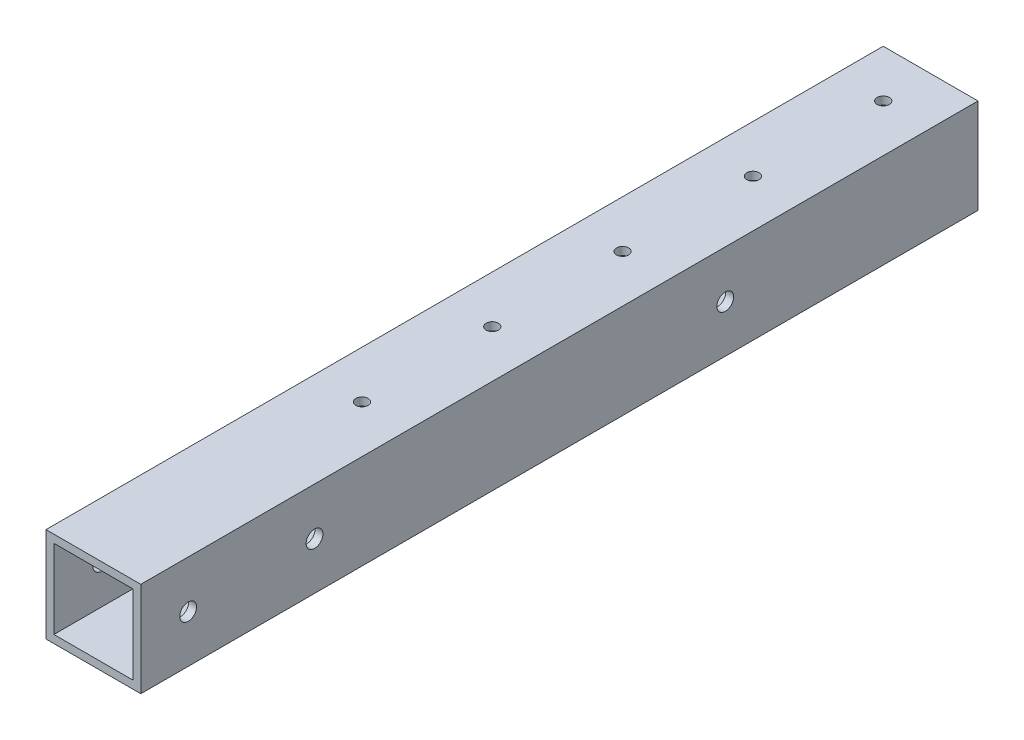
from build123d import *

# Parameters (mm, degrees)
BOSS_EXTRUDE1_DEPTH          = 165.1
BOSS_EXTRUDE1_DEPTH_BACK     = 171.45
SKETCH1_W                    = 38.1
SKETCH1_H                    = 38.1
SKETCH1_W_2                  = 31.75
SKETCH1_H_2                  = 31.75
F_1_4_CLEARANCE_HOLE1_D      = 6.7564
F_10_0_1935_DIAMETER_HOLE1_D = 4.9149


with BuildPart() as part:
    # Sketch1 → Boss-Extrude1 (new, two sides: drawn at the far end of the back side and taken through both)
    with BuildSketch(Plane.XY.offset(-BOSS_EXTRUDE1_DEPTH_BACK)):
        Rectangle(SKETCH1_W, SKETCH1_H)
        Rectangle(SKETCH1_W_2, SKETCH1_H_2, mode=Mode.SUBTRACT)
    extrude(amount=BOSS_EXTRUDE1_DEPTH + BOSS_EXTRUDE1_DEPTH_BACK)

    # 1/4 Clearance Hole1 (through all)
    with Locations(Plane(origin=(19.05, 0, 0), x_dir=(0, 0, -1), z_dir=(1, 0, 0))):
        with Locations((-146.05, 0), (69.85, 0), (-95.25, 0)):
            Hole(F_1_4_CLEARANCE_HOLE1_D / 2)

    # #10 (0.1935) Diameter Hole1 (through all)
    with Locations(Plane(origin=(0, 19.05, 0), x_dir=(1, 0, 0), z_dir=(0, 1, 0))):
        with Locations((0, -57.15), (0, 152.4), (0, 100.0125), (0, 47.625), (0, -4.7625)):
            Hole(F_10_0_1935_DIAMETER_HOLE1_D / 2)


solid = part.part
